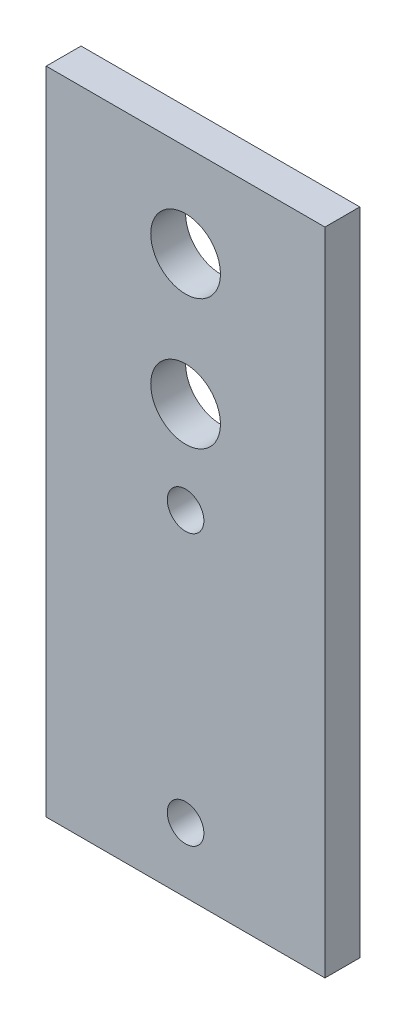
from build123d import *

# Parameters (mm, degrees)
SKETCH1_W           = 38.1
SKETCH1_H           = 88.9
SKETCH1_R           = 2.5
SKETCH1_R_2         = 4.7625
BOSS_EXTRUDE1_DEPTH = 4.7625


with BuildPart() as part:
    # Sketch1 → Boss-Extrude1 (new body)
    with BuildSketch(Plane.XY):
        with Locations((19.05, 44.45)):
            Rectangle(SKETCH1_W, SKETCH1_H)
        with Locations(Location((19.05, 8.85, 0), (0, 0, 180))):
            Circle(SKETCH1_R, mode=Mode.SUBTRACT)
        with Locations(Location((19.05, 45.85, 0), (0, 0, 180))):
            Circle(SKETCH1_R, mode=Mode.SUBTRACT)
        with Locations(Location((19.05, 76.2, 0), (0, 0, 180))):
            Circle(SKETCH1_R_2, mode=Mode.SUBTRACT)
        with Locations(Location((19.05, 58.42, 0), (0, 0, 180))):
            Circle(SKETCH1_R_2, mode=Mode.SUBTRACT)
    extrude(amount=BOSS_EXTRUDE1_DEPTH)


solid = part.part
